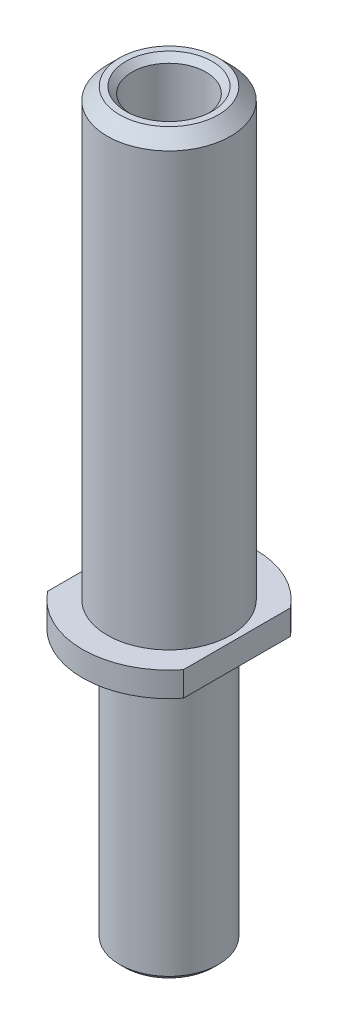
from build123d import *

# Parameters (mm, degrees)
CUT_EXTRUDE1_REACH = 32.406


with BuildPart() as part:
    # Sketch1 → Revolve1 (revolve)
    with BuildSketch(Plane(origin=(0, 0, 0), x_dir=(0, 0, -1), z_dir=(1, 0, 0))):
        Polygon((-1.5, 0.2), (-1.5, 29.75), (-1.75, 30), (-2, 30), (-2.5, 29.5), (-2.5, 12), (-3.5, 12), (-3.5, 11), (-2, 11), (-2, 0.2), (-1.8, 0), (-1.7, 0), align=None)
    revolve(axis=Axis((0, 30, 0), (0, -1, 0)))

    # Sketch2 → Cut-Extrude1 (cut, up to next)
    with BuildSketch(Plane(origin=(0, 0, 0), x_dir=(1, 0, 0), z_dir=(0, 1, 0)), mode=Mode.PRIVATE) as cut_extrude1_sk1:
        with BuildLine():
            Line((-2.75, 2.165063509), (-2.75, -2.165063509))
            ThreePointArc((-2.75, -2.165063509), (-3.5, 0), (-2.75, 2.165063509))
        make_face()
    cut_extrude1_tool1 = extrude(cut_extrude1_sk1.sketch, amount=CUT_EXTRUDE1_REACH, mode=Mode.PRIVATE) & part.part
    # Sketch2 → Cut-Extrude1 (cut, up to next)
    with BuildSketch(Plane(origin=(0, 0, 0), x_dir=(1, 0, 0), z_dir=(0, 1, 0)), mode=Mode.PRIVATE) as cut_extrude1_sk2:
        with BuildLine():
            Line((2.75, 2.165063509), (2.75, -2.165063509))
            ThreePointArc((2.75, -2.165063509), (3.5, 0), (2.75, 2.165063509))
        make_face()
    cut_extrude1_tool2 = extrude(cut_extrude1_sk2.sketch, amount=CUT_EXTRUDE1_REACH, mode=Mode.PRIVATE) & part.part
    add(cut_extrude1_tool1.solids().sort_by_distance((-3.052938, 0, 0))[0], mode=Mode.SUBTRACT)
    add(cut_extrude1_tool2.solids().sort_by_distance((3.052938, 0, 0))[0], mode=Mode.SUBTRACT)


solid = part.part
